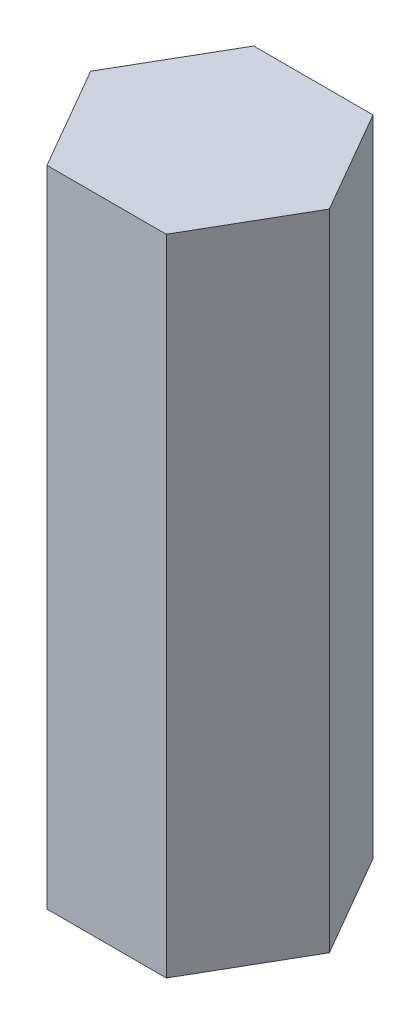
from build123d import *

# Parameters (mm, degrees)
BOSS_EXTRUDE1_DEPTH = 16.19
SKETCH3_R           = 1.6
CUT_EXTRUDE1_DEPTH  = 5


with BuildPart() as part:
    # Sketch1 → Boss-Extrude1 (new body)
    with BuildSketch(Plane(origin=(0, 0, 0), x_dir=(1, 0, 0), z_dir=(0, 1, 0))):
        Polygon((3, 0), (1.5, 2.598076211), (-1.5, 2.598076211), (-3, 0), (-1.5, -2.598076211), (1.5, -2.598076211), align=None)
    extrude(amount=BOSS_EXTRUDE1_DEPTH)

    # Sketch3 → Cut-Extrude1 (cut)
    with BuildSketch(Plane.XZ):
        with Locations(Location((0, 0, 0), (0, 0, 270))):
            Circle(SKETCH3_R)
    extrude(amount=-CUT_EXTRUDE1_DEPTH, mode=Mode.SUBTRACT)


solid = part.part
